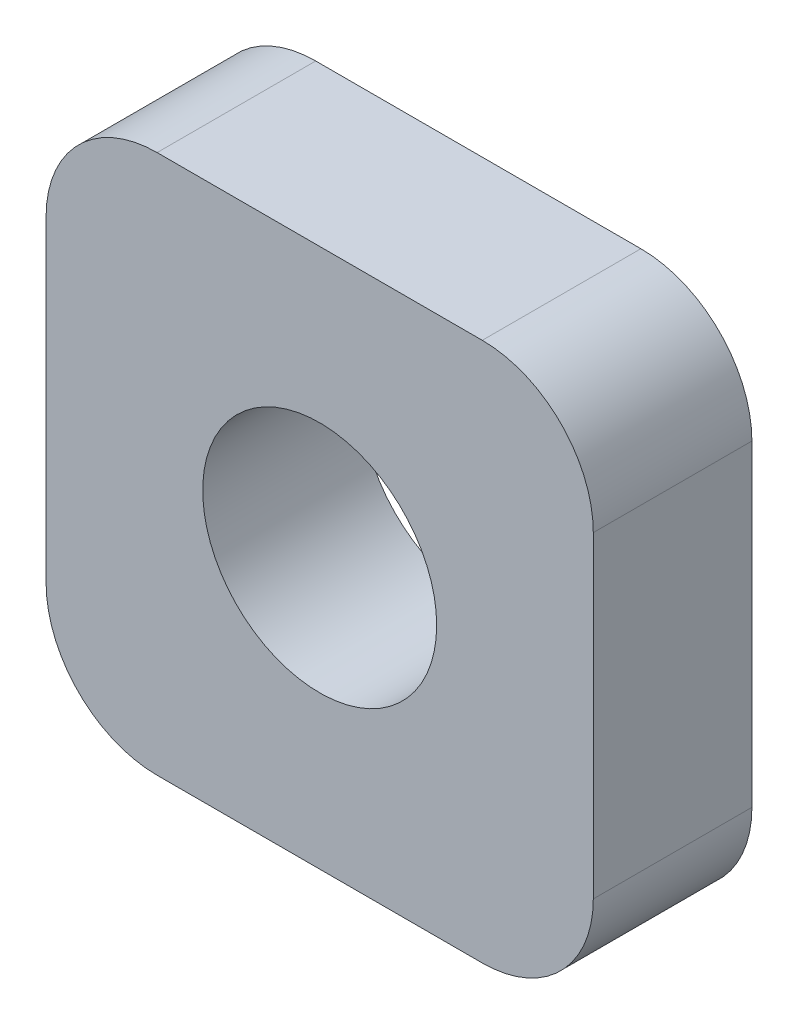
from build123d import *

# Parameters (mm, degrees)
SKETCH1_R           = 1.475
BOSS_EXTRUDE1_DEPTH = 2


with BuildPart() as part:
    # Sketch1 → Boss-Extrude1 (new body)
    with BuildSketch(Plane.XY):
        with BuildLine():
            Line((-3.45, 7), (-3.45, 3))
            ThreePointArc((-3.45, 3), (-3.039949494, 2.010050506), (-2.05, 1.6))
            Line((-2.05, 1.6), (2.05, 1.6))
            ThreePointArc((2.05, 1.6), (3.039949494, 2.010050506), (3.45, 3))
            Line((3.45, 3), (3.45, 7))
            ThreePointArc((3.45, 7), (3.039949494, 7.989949494), (2.05, 8.4))
            Line((2.05, 8.4), (-2.05, 8.4))
            ThreePointArc((-2.05, 8.4), (-3.039949494, 7.989949494), (-3.45, 7))
        make_face()
        with Locations((0, 5)):
            Circle(SKETCH1_R, mode=Mode.SUBTRACT)
    extrude(amount=BOSS_EXTRUDE1_DEPTH)


solid = part.part
